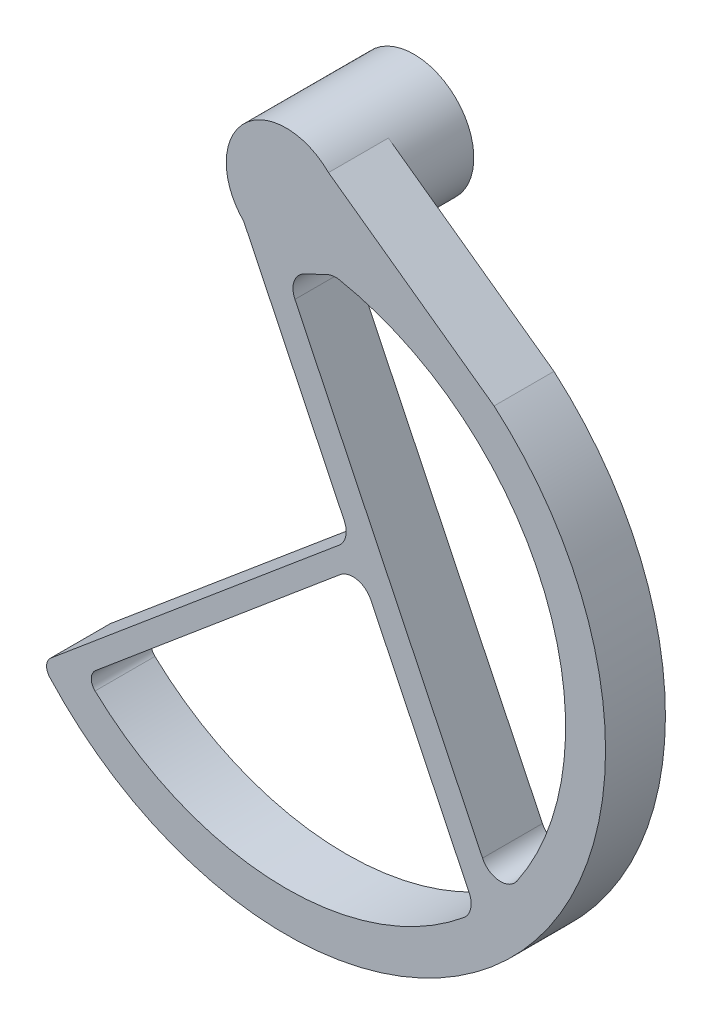
from build123d import *

# Parameters (mm, degrees)
EXTRUDE_1_DEPTH     = 15
CUT_EXTRUDE_START   = -15
CUT_EXTRUDE_1_DEPTH = 15
EXTRUDE_START       = 17
SKETCH_11_R         = 15
EXTRUDE_3_DEPTH     = 17
SKETCH_12_R         = 10
CUT_EXTRUDE_5_DEPTH = 2


with BuildPart() as part:
    # ｽｹｯﾁ4 → ﾎﾞｽ - 押し出し1 (new body)
    with BuildSketch(Plane.XY):
        with BuildLine():
            Line((-53.623111018, -124.995132678), (-58.940636287, -129.45706617))
            ThreePointArc((-58.940636287, -129.45706617), (-60.005384698, -131.552012131), (-59.233530865, -133.771635843))
            ThreePointArc((-59.233530865, -133.771635843), (57.362306223, -135.763481103), (52.076178918, -19.270504783))
            Line((52.076178918, -19.270504783), (10.606601718, 10.606601718))
            ThreePointArc((10.606601718, 10.606601718), (-10.606601718, 10.606601718), (-10.606601718, -10.606601718))
            Line((-10.606601718, -10.606601718), (14.536280154, -62.889638219))
            ThreePointArc((14.536280154, -62.889638219), (14.918089499, -66.109676181), (13.244185189, -68.886809092))
            Line((13.244185189, -68.886809092), (-53.623111018, -124.995132678))
        make_face()
        with BuildLine():
            Line((21.232400696, -76.813798404), (45.844843506, -127.993820346))
            ThreePointArc((45.844843506, -127.993820346), (46.221944165, -131.235480845), (44.518718993, -134.019289696))
            ThreePointArc((44.518718993, -134.019289696), (-2.231208213, -149.964431749), (-47.870174388, -131.072951785))
            ThreePointArc((-47.870174388, -131.072951785), (-48.817477846, -128.802229421), (-47.747678417, -126.586582094))
            Line((-47.747678417, -126.586582094), (13.511229465, -75.151532228))
            ThreePointArc((13.511229465, -75.151532228), (17.77869109, -74.092739753), (21.232400696, -76.813798404))
        make_face(mode=Mode.SUBTRACT)
    extrude(amount=EXTRUDE_1_DEPTH)

    # ｽｹｯﾁ6 → ｶｯﾄ - 押し出し1 (cut)
    with BuildSketch(Plane.XY.offset(15).offset(CUT_EXTRUDE_START)):
        with BuildLine():
            Line((49.189589797, -118.797265215), (2.201751786, -21.089020696))
            ThreePointArc((2.201751786, -21.089020696), (1.989274209, -17.268089629), (4.540836142, -14.416039025))
            Line((4.540836142, -14.416039025), (6.483415605, -13.48185369))
            Line((6.483415605, -13.48185369), (10.219658847, -11.685096486))
            ThreePointArc((10.219658847, -11.685096486), (11.747077013, -11.232198087), (13.339423466, -11.282754846))
            ThreePointArc((13.339423466, -11.282754846), (64.738421392, -53.37413296), (57.826055334, -119.448033215))
            ThreePointArc((57.826055334, -119.448033215), (53.319931874, -121.616182211), (49.189589797, -118.797265215))
        make_face()
    extrude(amount=CUT_EXTRUDE_1_DEPTH, mode=Mode.SUBTRACT)

    # ｽｹｯﾁ11 → ﾎﾞｽ - 押し出し3 (add)
    with BuildSketch(Plane(origin=(0, 0, 0), x_dir=(-1, 0, 0), z_dir=(0, 0, -1)).offset(EXTRUDE_START)):
        Circle(SKETCH_11_R)
    extrude(amount=-EXTRUDE_3_DEPTH)

    # ｽｹｯﾁ12 → ｶｯﾄ - 押し出し5 (cut)
    with BuildSketch(Plane(origin=(0, 0, -17), x_dir=(-1, 0, 0), z_dir=(0, 0, -1))):
        Circle(SKETCH_12_R)
    extrude(amount=-CUT_EXTRUDE_5_DEPTH, mode=Mode.SUBTRACT)


solid = part.part
